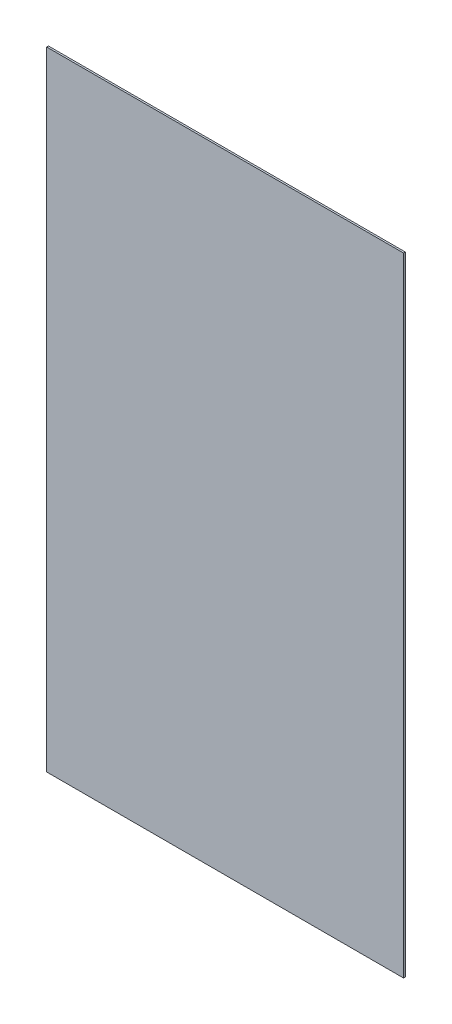
from build123d import *

# Parameters (mm, degrees)
SKETCH1_W           = 50
SKETCH1_H           = 88
BOSS_EXTRUDE1_DEPTH = 0.25


with BuildPart() as part:
    # Sketch1 → Boss-Extrude1 (new body)
    with BuildSketch(Plane.XY.offset(0.25)):
        with Locations((0, -2.482142857)):
            Rectangle(SKETCH1_W, SKETCH1_H)
    extrude(amount=-BOSS_EXTRUDE1_DEPTH)


solid = part.part
